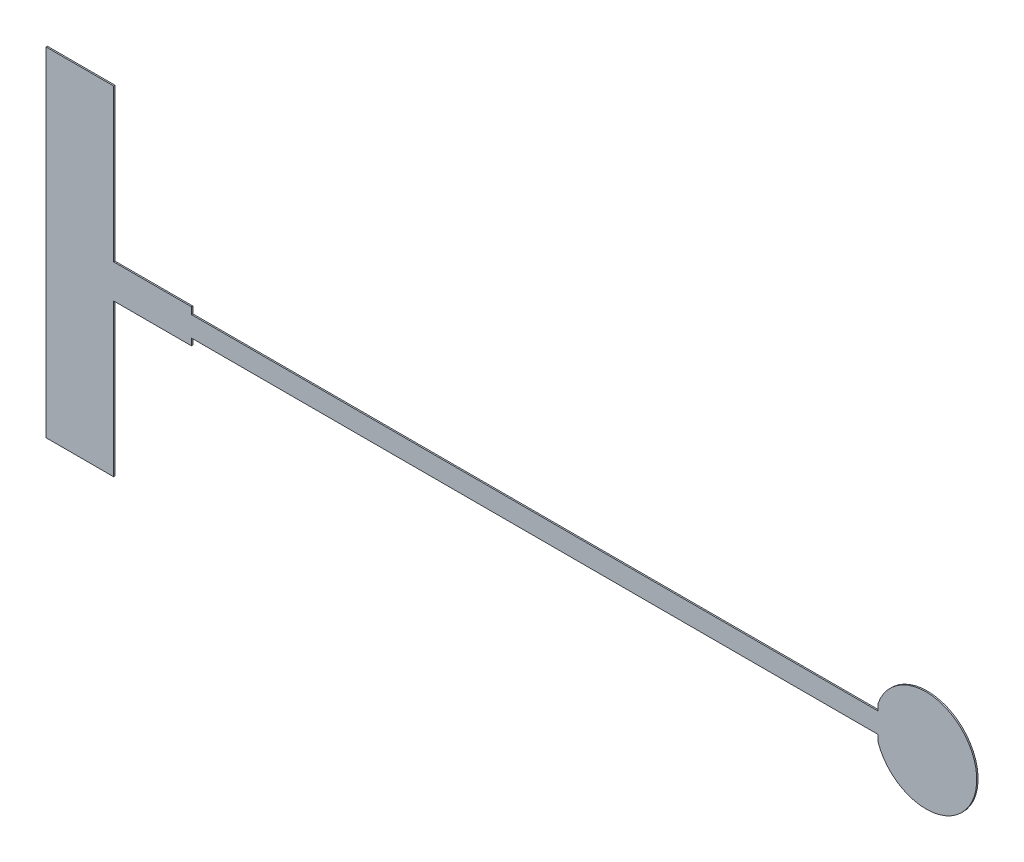
from build123d import *

# Parameters (mm, degrees)
BOSS_EXTRUDE1_DEPTH = 20
SKETCH2_W           = 1000
SKETCH2_H           = 2250
CUT_EXTRUDE1_DEPTH  = 12993.801853334
CUT_EXTRUDE4_DEPTH  = 12993.801853334
SKETCH5_W           = 11500
SKETCH5_H           = 500
BOSS_EXTRUDE2_DEPTH = 20
SKETCH7_W           = 10142.893218813
SKETCH7_H           = 100
CUT_EXTRUDE5_DEPTH  = 12993.801853334


with BuildPart() as part:
    # Sketch1 → Boss-Extrude1 (new body)
    with BuildSketch(Plane.XY):
        with BuildLine():
            Line((1000, 250), (5000, 250))
            Line((5000, 250), (5000, 125))
            Line((5000, 125), (9000, 125))
            Line((9000, 125), (9000, 100))
            Line((9000, 100), (11256.696562634, 100))
            ThreePointArc((11256.696562634, 100), (12750, 0), (11256.696562634, -100))
            Line((11256.696562634, -100), (9000, -100))
            Line((9000, -100), (9000, -125))
            Line((9000, -125), (5000, -125))
            Line((5000, -125), (5000, -250))
            Line((5000, -250), (1000, -250))
            Line((1000, -250), (1000, -2500))
            Line((1000, -2500), (-1000, -2500))
            Line((-1000, -2500), (-1000, 2500))
            Line((-1000, 2500), (1000, 2500))
            Line((1000, 2500), (1000, 250))
        make_face()
    extrude(amount=-BOSS_EXTRUDE1_DEPTH)

    # Sketch2 → Cut-Extrude1 (cut, through all)
    with BuildSketch(Plane.XY):
        with Locations((500, 1375)):
            Rectangle(SKETCH2_W, SKETCH2_H)
        with Locations((500, -1375)):
            Rectangle(SKETCH2_W, SKETCH2_H)
    extrude(amount=-CUT_EXTRUDE1_DEPTH, mode=Mode.SUBTRACT)

    # Sketch3 → Cut-Extrude4 (cut, through all)
    with BuildSketch(Plane.XY):
        Polygon((1500, -250), (3250, -250), (5000, -250), (5000, -150), (3250, -150), (3250, -200), (1500, -200), align=None)
    cut_extrude4 = extrude(amount=-CUT_EXTRUDE4_DEPTH, mode=Mode.SUBTRACT)

    # Mirror1: Cut-Extrude4 across plane
    add(cut_extrude4.mirror(Plane.ZX), mode=Mode.SUBTRACT)

    # Sketch5 → Boss-Extrude2 (add)
    with BuildSketch(Plane.XY):
        with Locations((5750, 0)):
            Rectangle(SKETCH5_W, SKETCH5_H)
    extrude(amount=-BOSS_EXTRUDE2_DEPTH)

    # Sketch7 → Cut-Extrude5 (cut, through all)
    with BuildSketch(Plane.XY):
        with Locations((6221.446609407, 200)):
            Rectangle(SKETCH7_W, SKETCH7_H)
    cut_extrude5 = extrude(amount=-CUT_EXTRUDE5_DEPTH, mode=Mode.SUBTRACT)

    # Mirror2: Cut-Extrude5 across plane
    add(cut_extrude5.mirror(Plane.ZX), mode=Mode.SUBTRACT)


solid = part.part
